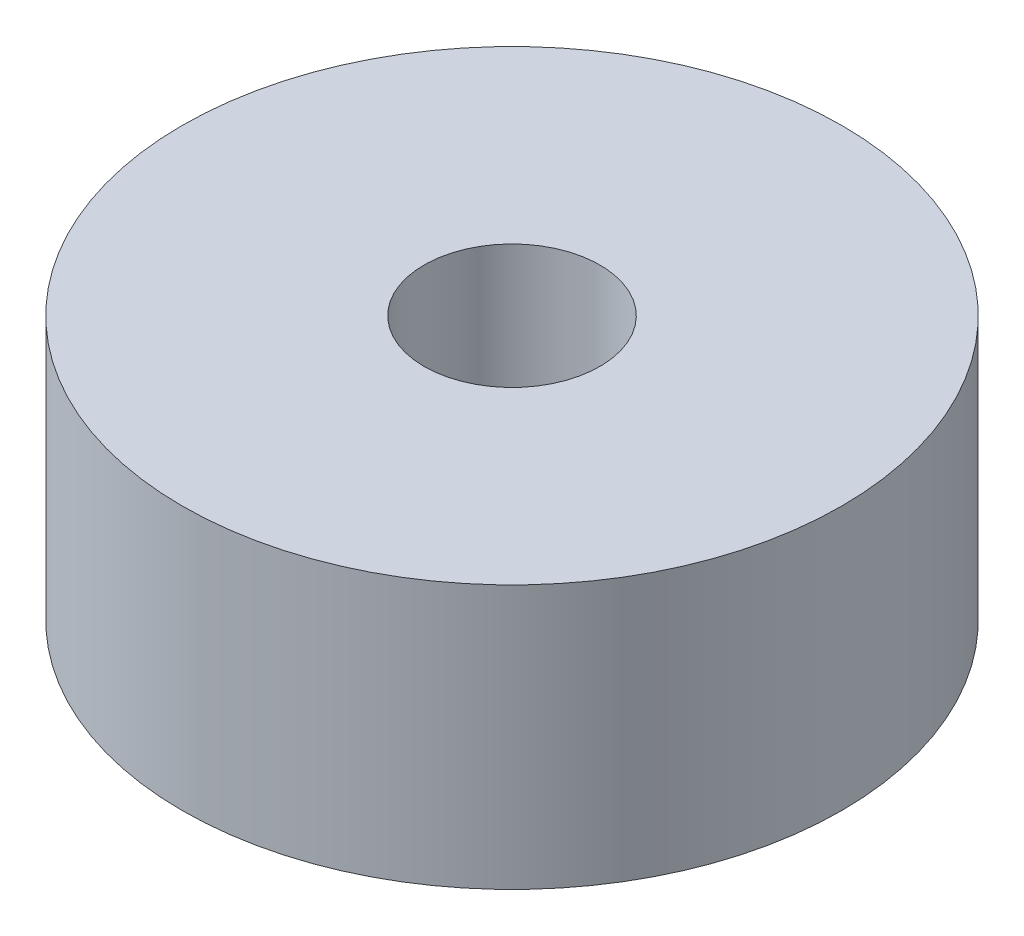
from build123d import *

# Parameters (mm, degrees)
SKETCH1_R           = 15
SKETCH1_R_2         = 4
BOSS_EXTRUDE1_DEPTH = 12


with BuildPart() as part:
    # Sketch1 → Boss-Extrude1 (new body)
    with BuildSketch(Plane(origin=(0, 0, 0), x_dir=(1, 0, 0), z_dir=(0, 1, 0))):
        with Locations(Location((0, 0, 0), (0, 0, 270))):
            Circle(SKETCH1_R)
        with Locations(Location((0, 0, 0), (0, 0, 270))):
            Circle(SKETCH1_R_2, mode=Mode.SUBTRACT)
    extrude(amount=BOSS_EXTRUDE1_DEPTH)


solid = part.part
